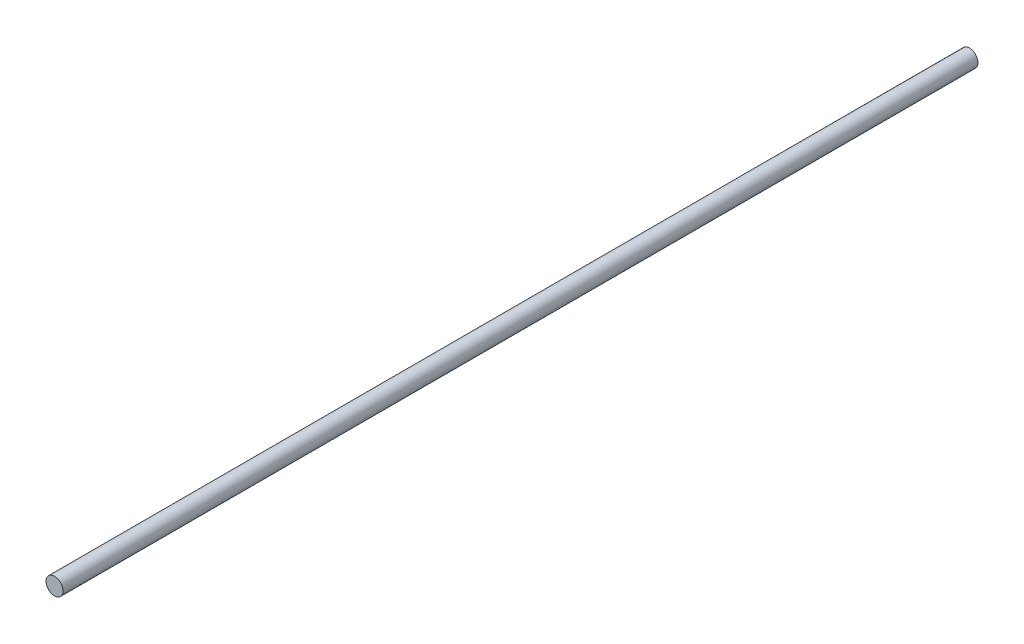
from build123d import *

# Parameters (mm, degrees)
SKETCH1_R           = 4
BOSS_EXTRUDE1_DEPTH = 430


with BuildPart() as part:
    # Sketch1 → Boss-Extrude1 (new body)
    with BuildSketch(Plane.XY):
        Circle(SKETCH1_R)
    extrude(amount=BOSS_EXTRUDE1_DEPTH)


solid = part.part
